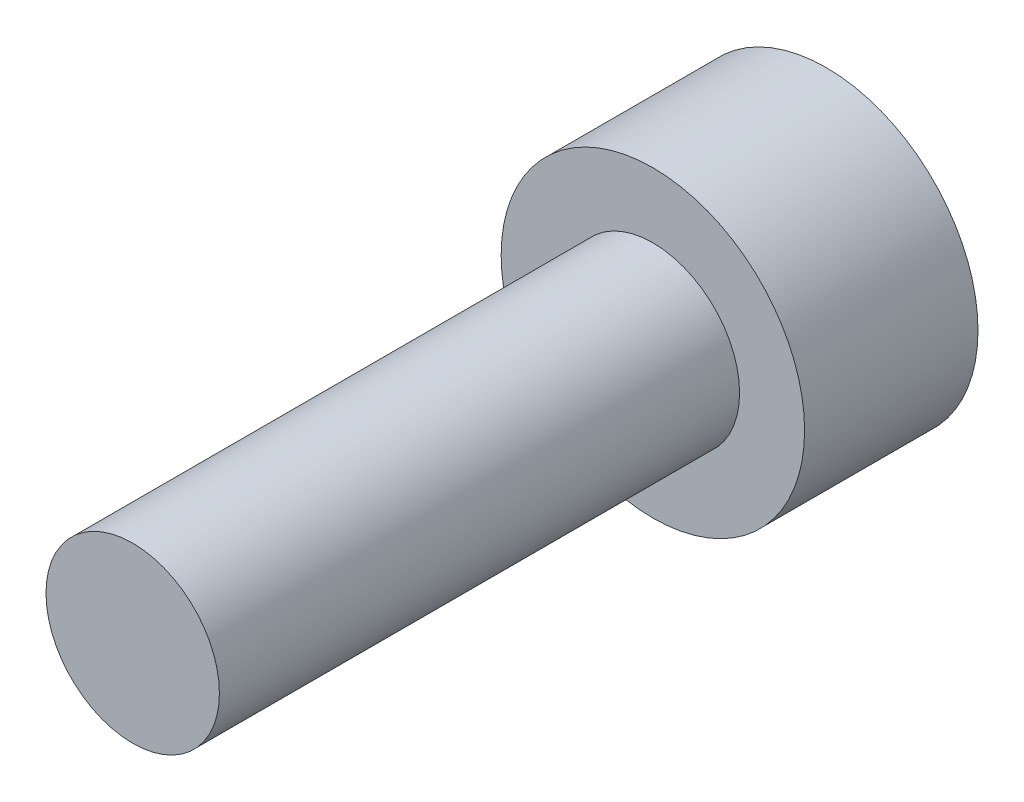
from build123d import *

# Parameters (mm, degrees)
HEAD_ENVELOPE_START         = -4
SKETCH1_R                   = 3.5
HEAD_ENVELOPE_DEPTH         = 4
SKETCH2_R                   = 2
THREAD_MAJOR_ENVELOPE_DEPTH = 12


with BuildPart() as part:
    # Sketch1 → Head_Envelope (new body)
    with BuildSketch(Plane.XY.offset(HEAD_ENVELOPE_START)):
        Circle(SKETCH1_R)
    extrude(amount=HEAD_ENVELOPE_DEPTH)

    # Sketch2 → Thread_Major_Envelope (add)
    with BuildSketch(Plane.XY):
        Circle(SKETCH2_R)
    extrude(amount=THREAD_MAJOR_ENVELOPE_DEPTH)


solid = part.part
